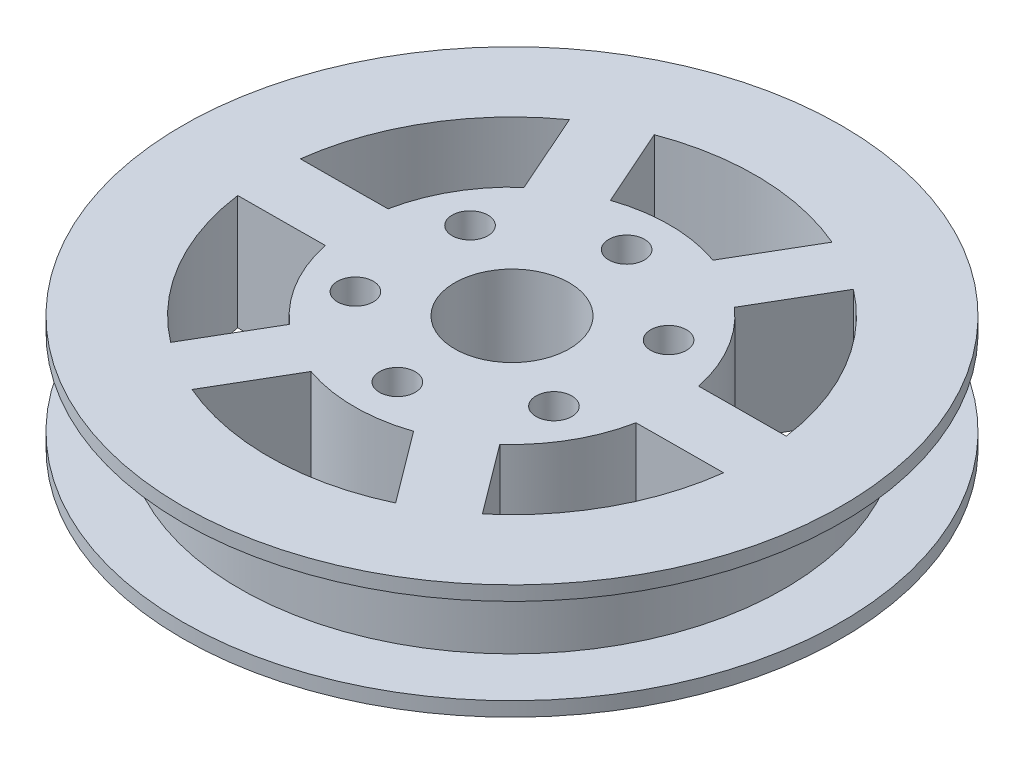
from build123d import *

# Parameters (mm, degrees)
SKETCH2_R               = 60.325
SKETCH2_R_2             = 3.96875
SKETCH2_R_3             = 12.7
BOSS_EXTRUDE1_DEPTH     = 19.05
SKETCH3_R               = 73.025
SKETCH3_R_2             = 3.96875
SKETCH3_R_3             = 12.7
BOSS_EXTRUDE2_DEPTH     = 3.175
BOSS_EXTRUDE3_START     = 3.175
SKETCH4_R               = 73.025
SKETCH4_R_2             = 12.7
SKETCH4_R_3             = 3.96875
BOSS_EXTRUDE3_DEPTH     = 3.175
CUT_EXTRUDE3_DEPTH      = 106.637360224
CUT_EXTRUDE3_DEPTH_BACK = 106.637360224


with BuildPart() as part:
    # Sketch2 → Boss-Extrude1 (new body)
    with BuildSketch(Plane(origin=(0, 0, 0), x_dir=(1, 0, 0), z_dir=(0, 1, 0))):
        with Locations(Location((0, 0, 0), (0, 0, 90))):
            Circle(SKETCH2_R)
        with Locations(Location((0, 25.4, 0), (0, 0, 90))):
            Circle(SKETCH2_R_2, mode=Mode.SUBTRACT)
        with Locations(Location((21.997045256, 12.7, 0), (0, 0, 90))):
            Circle(SKETCH2_R_2, mode=Mode.SUBTRACT)
        with Locations(Location((21.997045256, -12.7, 0), (0, 0, 90))):
            Circle(SKETCH2_R_2, mode=Mode.SUBTRACT)
        with Locations(Location((0, -25.4, 0), (0, 0, 90))):
            Circle(SKETCH2_R_2, mode=Mode.SUBTRACT)
        with Locations(Location((-21.997045256, -12.7, 0), (0, 0, 90))):
            Circle(SKETCH2_R_2, mode=Mode.SUBTRACT)
        with Locations(Location((-21.997045256, 12.7, 0), (0, 0, 90))):
            Circle(SKETCH2_R_2, mode=Mode.SUBTRACT)
        with Locations(Location((0, 0, 0), (0, 0, 90))):
            Circle(SKETCH2_R_3, mode=Mode.SUBTRACT)
    extrude(amount=BOSS_EXTRUDE1_DEPTH)

    # Sketch3 → Boss-Extrude2 (add)
    with BuildSketch(Plane(origin=(0, 19.05, 0), x_dir=(1, 0, 0), z_dir=(0, 1, 0))):
        with Locations(Location((0, 0, 0), (0, 0, 270))):
            Circle(SKETCH3_R)
        with Locations(Location((0, 25.4, 0), (0, 0, 90))):
            Circle(SKETCH3_R_2, mode=Mode.SUBTRACT)
        with Locations(Location((21.997045256, 12.7, 0), (0, 0, 90))):
            Circle(SKETCH3_R_2, mode=Mode.SUBTRACT)
        with Locations(Location((21.997045256, -12.7, 0), (0, 0, 90))):
            Circle(SKETCH3_R_2, mode=Mode.SUBTRACT)
        with Locations(Location((0, -25.4, 0), (0, 0, 90))):
            Circle(SKETCH3_R_2, mode=Mode.SUBTRACT)
        with Locations(Location((-21.997045256, -12.7, 0), (0, 0, 90))):
            Circle(SKETCH3_R_2, mode=Mode.SUBTRACT)
        with Locations(Location((0, 0, 0), (0, 0, 90))):
            Circle(SKETCH3_R_3, mode=Mode.SUBTRACT)
        with Locations(Location((-21.997045256, 12.7, 0), (0, 0, 90))):
            Circle(SKETCH3_R_2, mode=Mode.SUBTRACT)
    extrude(amount=BOSS_EXTRUDE2_DEPTH)

    # Sketch4 → Boss-Extrude3 (add)
    with BuildSketch(Plane.XZ.offset(BOSS_EXTRUDE3_START)):
        with Locations(Location((0, 0, 0), (0, 0, 90))):
            Circle(SKETCH4_R)
        with Locations(Location((0, 0, 0), (0, 0, 270))):
            Circle(SKETCH4_R_2, mode=Mode.SUBTRACT)
        with Locations(Location((-21.997045256, -12.7, 0), (0, 0, 270))):
            Circle(SKETCH4_R_3, mode=Mode.SUBTRACT)
        with Locations(Location((0, -25.4, 0), (0, 0, 270))):
            Circle(SKETCH4_R_3, mode=Mode.SUBTRACT)
        with Locations(Location((21.997045256, -12.7, 0), (0, 0, 270))):
            Circle(SKETCH4_R_3, mode=Mode.SUBTRACT)
        with Locations(Location((21.997045256, 12.7, 0), (0, 0, 270))):
            Circle(SKETCH4_R_3, mode=Mode.SUBTRACT)
        with Locations(Location((0, 25.4, 0), (0, 0, 270))):
            Circle(SKETCH4_R_3, mode=Mode.SUBTRACT)
        with Locations(Location((-21.997045256, 12.7, 0), (0, 0, 270))):
            Circle(SKETCH4_R_3, mode=Mode.SUBTRACT)
    extrude(amount=-BOSS_EXTRUDE3_DEPTH)

    # Sketch9 → Cut-Extrude3 (cut, two sides: drawn at the far end of the back side and taken through both)
    with BuildSketch(Plane(origin=(0, 0, 0), x_dir=(1, 0, 0), z_dir=(0, 1, 0)).offset(-CUT_EXTRUDE3_DEPTH_BACK)):
        with BuildLine():
            ThreePointArc((-53.47911905, -7.299619899), (-46.638038937, -27.169724863), (-32.727191245, -42.921225264))
            Line((-32.727191245, -42.921225264), (-23.004737979, -26.278083178))
            ThreePointArc((-23.004737979, -26.278083178), (-30.1427228, -17.640064829), (-34.177703438, -7.186112487))
            Line((-34.177703438, -7.186112487), (-53.47911905, -7.299619899))
        make_face()
        with BuildLine():
            ThreePointArc((-31.283856312, 43.984326291), (-46.343943604, 27.668384778), (-53.561272173, 6.670138541))
            Line((-53.561272173, 6.670138541), (-34.259856576, 6.783645952))
            ThreePointArc((-34.259856576, 6.783645952), (-30.348105608, 17.284331372), (-23.312207546, 26.005703304))
            Line((-23.312207546, 26.005703304), (-31.283856312, 43.984326291))
        make_face()
        with BuildLine():
            ThreePointArc((21.314275493, 49.588328115), (1.249191015, 53.960542499), (-18.996723984, 50.521531082))
            Line((-18.996723984, 50.521531082), (-11.255118383, 33.061729162))
            ThreePointArc((-11.255118383, 33.061729162), (0.178151467, 34.924545624), (11.591822226, 32.945186029))
            Line((11.591822226, 32.945186029), (21.314275493, 49.588328115))
        make_face()
        with BuildLine():
            Line((34.177703478, 7.186112301), (53.479119075, 7.299619712))
            ThreePointArc((53.479119075, 7.299619712), (46.638038984, 27.169724781), (32.727191245, 42.921225264))
            Line((32.727191245, 42.921225264), (23.004737979, 26.278083178))
            ThreePointArc((23.004737979, 26.278083178), (30.142722848, 17.640064747), (34.177703478, 7.186112301))
        make_face()
        with BuildLine():
            Line((23.312207688, -26.005703177), (34.742784352, -41.306652739))
            ThreePointArc((34.742784352, -41.306652739), (47.427034742, -25.767751175), (53.56127215, -6.670138728))
            Line((53.56127215, -6.670138728), (34.259856539, -6.783646139))
            ThreePointArc((34.259856539, -6.783646139), (30.348105608, -17.284331372), (23.312207688, -26.005703177))
        make_face()
        with BuildLine():
            Line((-11.591822226, -32.945186029), (-21.314275493, -49.588328115))
            ThreePointArc((-21.314275493, -49.588328115), (0.938377322, -53.966842348), (23.025356811, -48.817349054))
            Line((23.025356811, -48.817349054), (11.255118563, -33.061729101))
            ThreePointArc((11.255118563, -33.061729101), (-0.178151371, -34.924545625), (-11.591822226, -32.945186029))
        make_face()
    extrude(amount=CUT_EXTRUDE3_DEPTH + CUT_EXTRUDE3_DEPTH_BACK, mode=Mode.SUBTRACT)


solid = part.part
